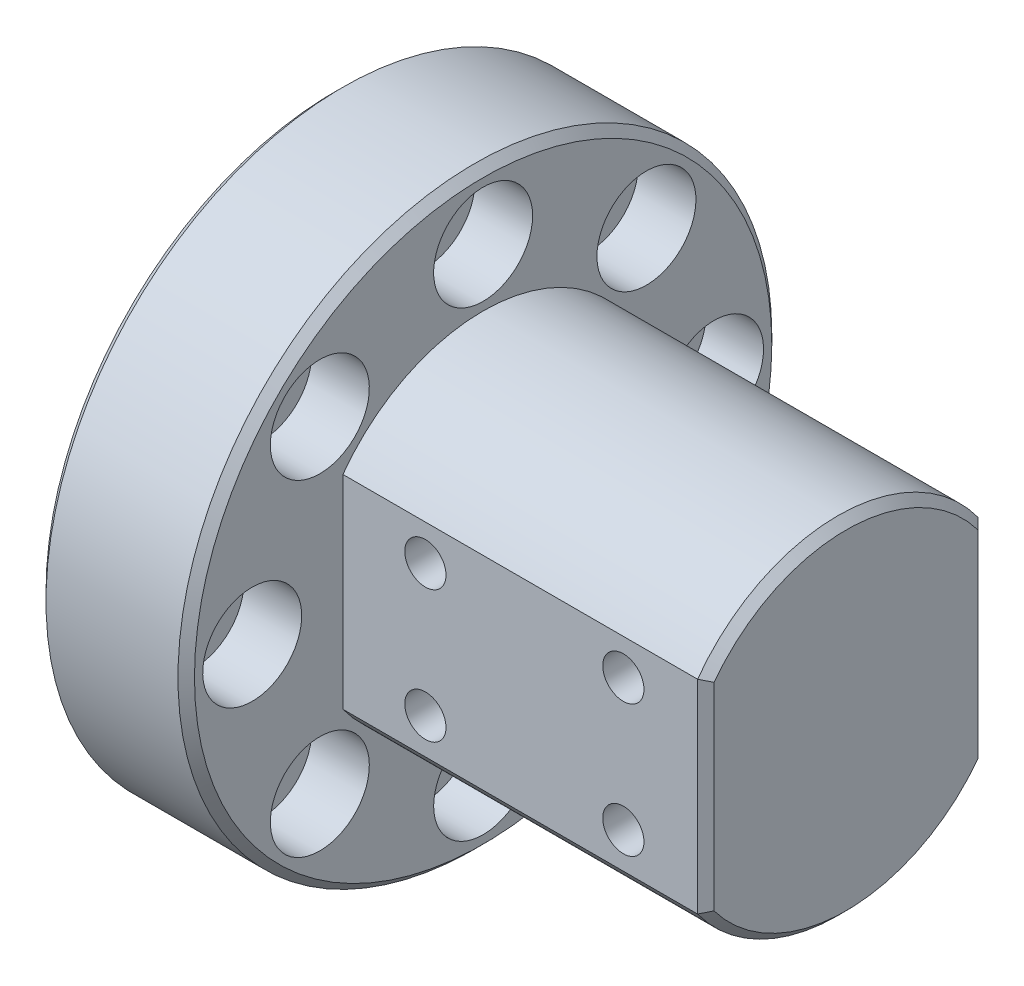
from build123d import *

# Parameters (mm, degrees)
SKETCH1_R           = 18
BOSS_EXTRUDE1_DEPTH = 9
SKETCH2_R           = 10.5
BOSS_EXTRUDE2_DEPTH = 22
SKETCH3_R           = 1.75
CUT_EXTRUDE2_DEPTH  = 34.645207683
SKETCH3_3_R         = 3
SKETCH3_3_R_2       = 1.75
CUT_EXTRUDE3_DEPTH  = 3.5
CIRPATTERN1_COUNT   = 8
CHAMFER1_SIZE       = 0.5
CUT_EXTRUDE4_DEPTH  = 34.645207683
M3_TAPPED_HOLE1_D   = 2.5
CHAMFER2_SIZE       = 0.5


with BuildPart() as part:
    # Sketch1 → Boss-Extrude1 (new body)
    with BuildSketch(Plane(origin=(0, 0, 0), x_dir=(0, 0, -1), z_dir=(1, 0, 0))):
        Circle(SKETCH1_R)
    extrude(amount=BOSS_EXTRUDE1_DEPTH)

    # Sketch2 → Boss-Extrude2 (add)
    with BuildSketch(Plane(origin=(9, 0, 0), x_dir=(0, 0, -1), z_dir=(1, 0, 0))):
        Circle(SKETCH2_R)
    extrude(amount=BOSS_EXTRUDE2_DEPTH)

    # Sketch3 → Cut-Extrude2 (cut, through all)
    with BuildSketch(Plane(origin=(9, 0, 0), x_dir=(0, 0, -1), z_dir=(1, 0, 0))):
        with Locations((0, 14)):
            Circle(SKETCH3_R)
    cut_extrude2 = extrude(amount=-CUT_EXTRUDE2_DEPTH, mode=Mode.SUBTRACT)

    # Sketch3<3> → Cut-Extrude3 (cut)
    with BuildSketch(Plane(origin=(9, 0, 0), x_dir=(0, 0, -1), z_dir=(1, 0, 0))):
        with Locations((0, 14)):
            Circle(SKETCH3_3_R)
        with Locations((0, 14)):
            Circle(SKETCH3_3_R_2, mode=Mode.SUBTRACT)
    cut_extrude3 = extrude(amount=-CUT_EXTRUDE3_DEPTH, mode=Mode.SUBTRACT)

    # CirPattern1: Cut-Extrude2, Cut-Extrude3 ×8 about axis
    cirpattern1_axis = Axis((31, 0, 0), (-1, 0, 0))
    add([cut_extrude2.rotate(cirpattern1_axis, i * 360 / CIRPATTERN1_COUNT) for i in range(1, CIRPATTERN1_COUNT)], mode=Mode.SUBTRACT)
    add([cut_extrude3.rotate(cirpattern1_axis, i * 360 / CIRPATTERN1_COUNT) for i in range(1, CIRPATTERN1_COUNT)], mode=Mode.SUBTRACT)

    # Chamfer1
    chamfer1_edges = [part.edges().sort_by_distance(p)[0] for p in [
        (9, 0, 18),
        (0, 0, 18),
    ]]
    chamfer(chamfer1_edges, length=CHAMFER1_SIZE)

    # Sketch4 → Cut-Extrude4 (cut, through all)
    with BuildSketch(Plane(origin=(9, 0, 0), x_dir=(0, 0, -1), z_dir=(1, 0, 0))):
        with BuildLine():
            Line((-8.5, -6.164414003), (-8.5, 6.164414003))
            ThreePointArc((-8.5, 6.164414003), (-10.5, 0), (-8.5, -6.164414003))
        make_face()
        with BuildLine():
            ThreePointArc((8.5, -6.164414003), (10.5, 0), (8.5, 6.164414003))
            Line((8.5, 6.164414003), (8.5, -6.164414003))
        make_face()
    extrude(amount=CUT_EXTRUDE4_DEPTH, mode=Mode.SUBTRACT)

    # M3 Tapped Hole1 (through all)
    with Locations(Plane(origin=(14, 4, 8.5), x_dir=(1, 0, 0), z_dir=(0, 0, 1))):
        with Locations((0, 0), (12, 0), (0, -8), (12, -8)):
            Hole(M3_TAPPED_HOLE1_D / 2)

    # Chamfer2
    chamfer2_edges = [part.edges().sort_by_distance(p)[0] for p in [
        (31, 0, -8.5),
        (31, -10.5, 0),
        (31, 0, 8.5),
        (31, 10.5, 0),
    ]]
    chamfer(chamfer2_edges, length=CHAMFER2_SIZE)


solid = part.part
